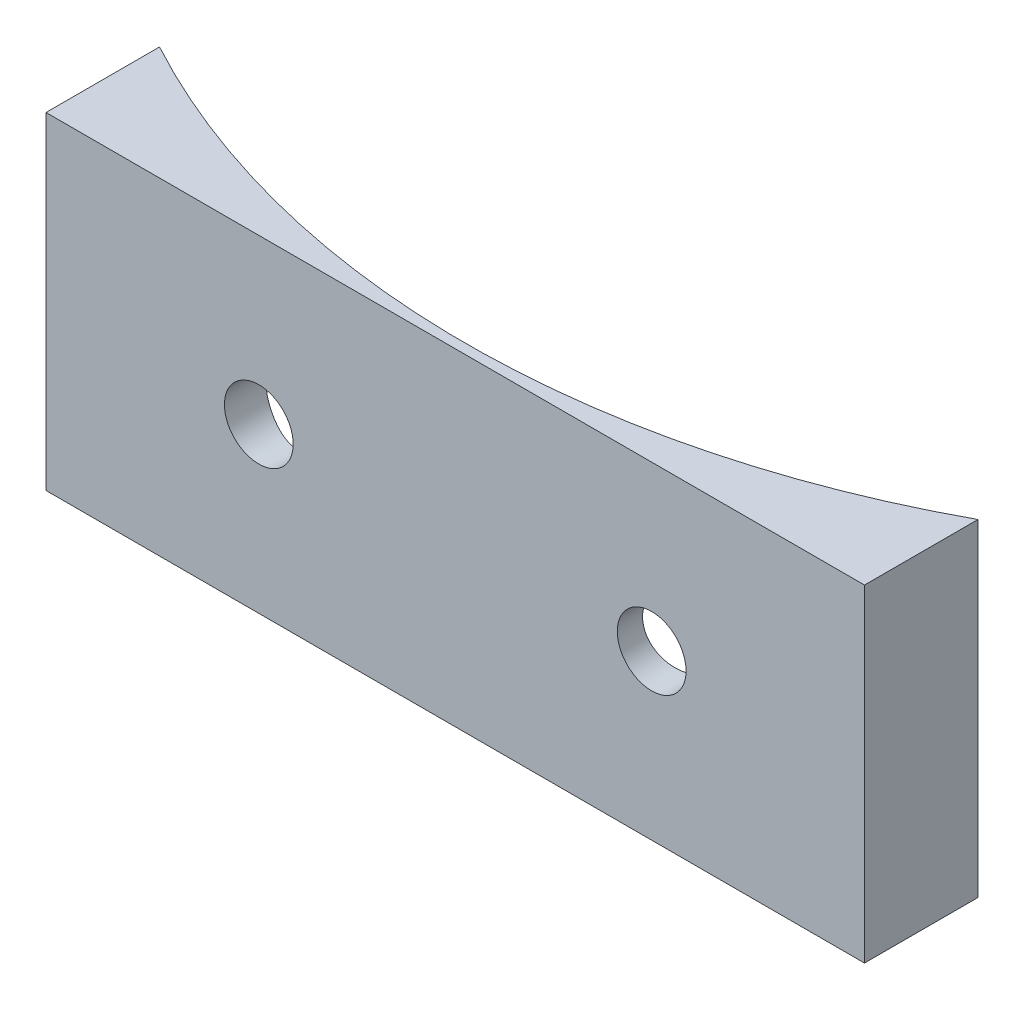
from build123d import *

# Parameters (mm, degrees)
EXTRUDE_1_DEPTH     = 20
SKETCH_2_R          = 2.1
CUT_EXTRUDE_1_DEPTH = 20


with BuildPart() as part:
    # Эскиз1 → Бобышка-Вытянуть1 (new body)
    with BuildSketch(Plane(origin=(0, 0, 0), x_dir=(1, 0, 0), z_dir=(0, 1, 0))):
        with BuildLine():
            Line((-25, -46.165463282), (-25, -53.1))
            Line((-25, -53.1), (25, -53.1))
            Line((25, -53.1), (25, -46.165463282))
            ThreePointArc((25, -46.165463282), (0, -52.5), (-25, -46.165463282))
        make_face()
    extrude(amount=EXTRUDE_1_DEPTH)

    # Эскиз2 → Вырез-Вытянуть1 (cut)
    with BuildSketch(Plane.XY.offset(53.1)):
        with Locations((-12, 10)):
            Circle(SKETCH_2_R)
        with Locations((12, 10)):
            Circle(SKETCH_2_R)
    extrude(amount=-CUT_EXTRUDE_1_DEPTH, mode=Mode.SUBTRACT)


solid = part.part
